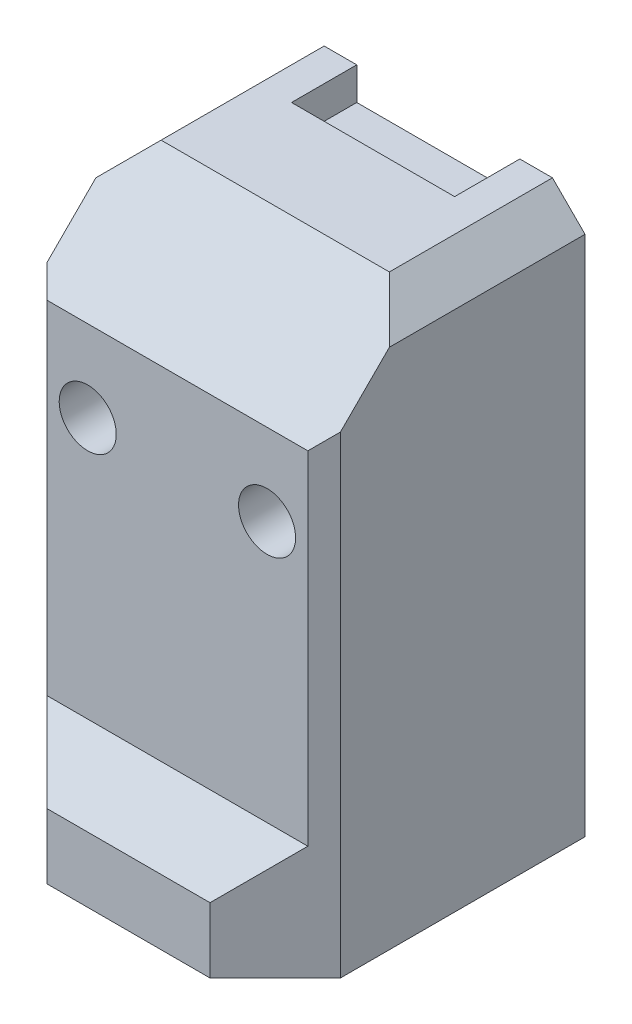
from build123d import *

# Parameters (mm, degrees)
SKETCH1_W           = 18
SKETCH1_H           = 34
SKETCH1_R           = 1.75
BOSS_EXTRUDE1_DEPTH = 19
CUT_EXTRUDE1_DEPTH  = 18
CHAMFER1_SIZE       = 6
CHAMFER2_SIZE       = 2
CHAMFER3_SIZE       = 4
SKETCH3_W           = 10
SKETCH3_H           = 4
CUT_EXTRUDE2_DEPTH  = 2


with BuildPart() as part:
    # Sketch1 → Boss-Extrude1 (new body)
    with BuildSketch(Plane.XY):
        Rectangle(SKETCH1_W, SKETCH1_H)
        with Locations((5.5, 6)):
            Circle(SKETCH1_R, mode=Mode.SUBTRACT)
        with Locations((-5.5, 6)):
            Circle(SKETCH1_R, mode=Mode.SUBTRACT)
    extrude(amount=BOSS_EXTRUDE1_DEPTH)

    # Sketch2 → Cut-Extrude1 (cut)
    with BuildSketch(Plane(origin=(9, 0, 0), x_dir=(0, 0, -1), z_dir=(1, 0, 0))):
        Polygon((-19, 17), (-16, 17), (-16, -10), (-19, -13), align=None)
    extrude(amount=-CUT_EXTRUDE1_DEPTH, mode=Mode.SUBTRACT)

    # Chamfer1
    chamfer1_edges = [part.edges().sort_by_distance(p)[0] for p in [
        (0, 17, 16),
    ]]
    chamfer(chamfer1_edges, length=CHAMFER1_SIZE)

    # Chamfer2
    chamfer2_edges = [part.edges().sort_by_distance(p)[0] for p in [
        (-9, 17, 5),
        (9, 17, 5),
    ]]
    chamfer(chamfer2_edges, length=CHAMFER2_SIZE)

    # Chamfer3
    chamfer3_edges = [part.edges().sort_by_distance(p)[0] for p in [
        (-9, -15, 19),
        (9, -15, 19),
    ]]
    chamfer(chamfer3_edges, length=CHAMFER3_SIZE)

    # Sketch3 → Cut-Extrude2 (cut)
    with BuildSketch(Plane(origin=(0, 17, 0), x_dir=(1, 0, 0), z_dir=(0, 1, 0))):
        with Locations((0, -2)):
            Rectangle(SKETCH3_W, SKETCH3_H)
    extrude(amount=-CUT_EXTRUDE2_DEPTH, mode=Mode.SUBTRACT)


solid = part.part
